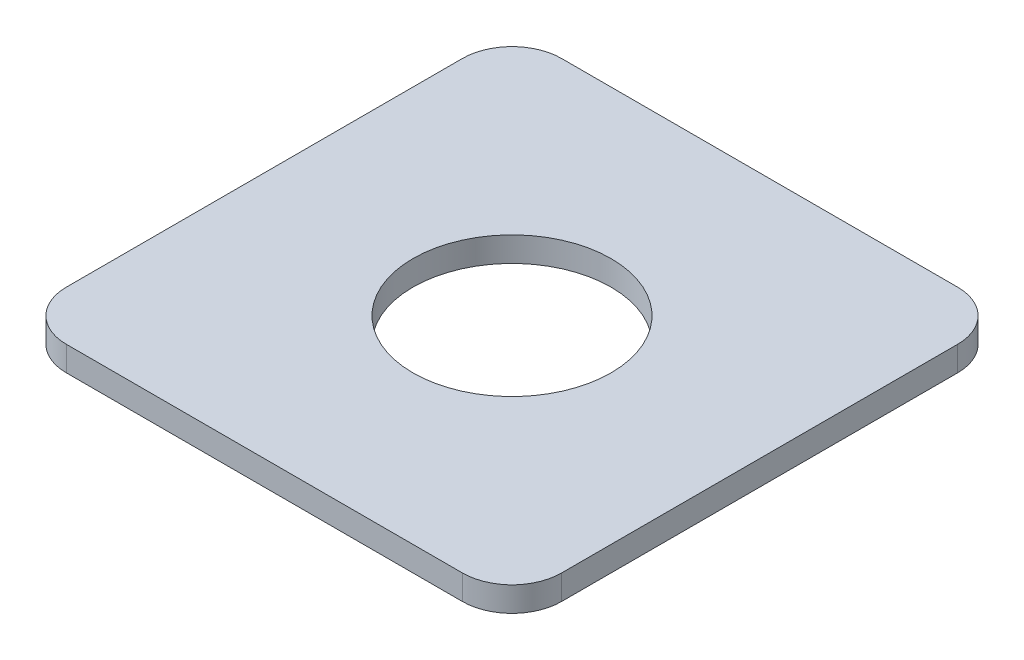
from build123d import *

# Parameters (mm, degrees)
SKETCH2_W           = 10
SKETCH2_H           = 10
BOSS_EXTRUDE1_DEPTH = 0.5
FILLET1_R           = 1
SKETCH3_R           = 2
CUT_EXTRUDE1_DEPTH  = 0.5


with BuildPart() as part:
    # Sketch2 → Boss-Extrude1 (new body)
    with BuildSketch(Plane(origin=(0, 0, 0), x_dir=(1, 0, 0), z_dir=(0, 1, 0))):
        Rectangle(SKETCH2_W, SKETCH2_H)
    extrude(amount=BOSS_EXTRUDE1_DEPTH)

    # Fillet1
    fillet1_edges = [part.edges().sort_by_distance(p)[0] for p in [
        (-5, 0.25, -5),
        (5, 0.25, -5),
        (5, 0.25, 5),
        (-5, 0.25, 5),
    ]]
    fillet(fillet1_edges, radius=FILLET1_R)

    # Sketch3 → Cut-Extrude1 (cut)
    with BuildSketch(Plane(origin=(0, 0.5, 0), x_dir=(1, 0, 0), z_dir=(0, 1, 0))):
        with Locations(Location((0, 0, 0), (0, 0, 270))):
            Circle(SKETCH3_R)
    extrude(amount=-CUT_EXTRUDE1_DEPTH, mode=Mode.SUBTRACT)


solid = part.part
